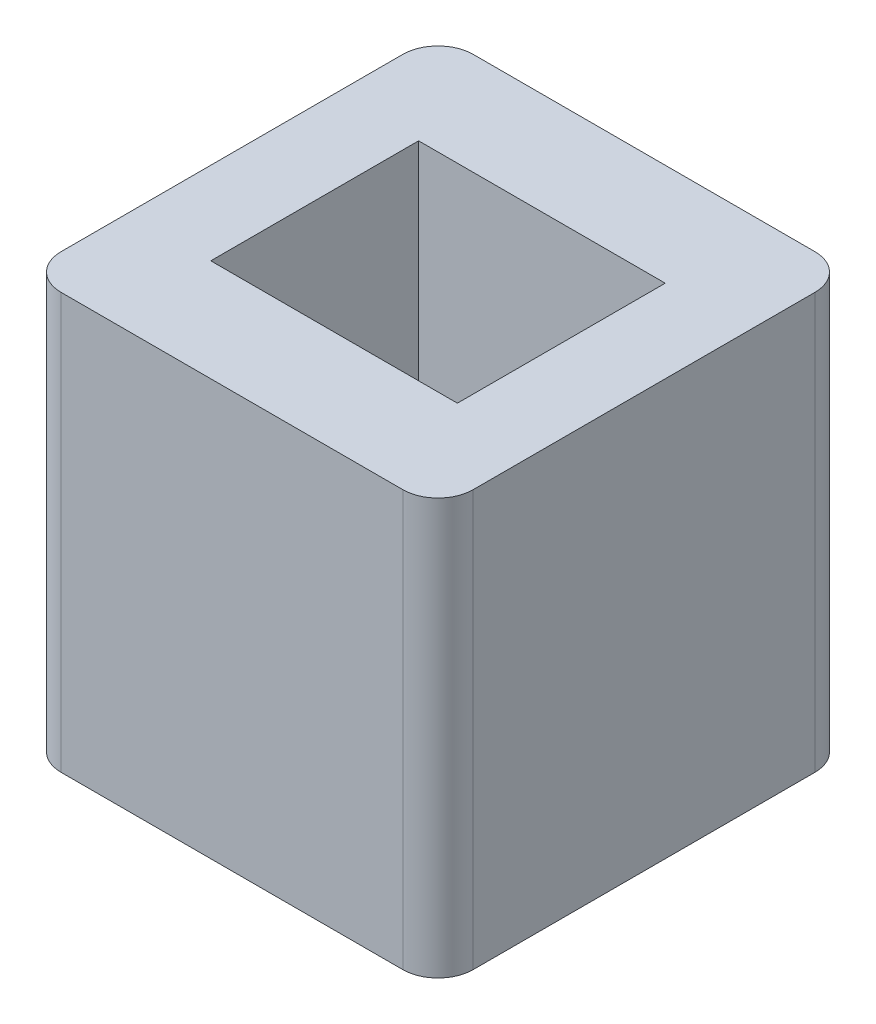
from build123d import *

# Parameters (mm, degrees)
SKETCH1_W           = 35
SKETCH1_H           = 29.5
BOSS_EXTRUDE1_DEPTH = 29.5


with BuildPart() as part:
    # Sketch1 → Boss-Extrude1 (new, symmetric)
    with BuildSketch(Plane(origin=(0, 0, 0), x_dir=(1, 0, 0), z_dir=(0, 1, 0))):
        with BuildLine():
            Line((-24.25, 29.25), (24.25, 29.25))
            ThreePointArc((24.25, 29.25), (27.785533906, 27.785533906), (29.25, 24.25))
            Line((29.25, 24.25), (29.25, -24.25))
            ThreePointArc((29.25, -24.25), (27.785533906, -27.785533906), (24.25, -29.25))
            Line((24.25, -29.25), (-24.25, -29.25))
            ThreePointArc((-24.25, -29.25), (-27.785533906, -27.785533906), (-29.25, -24.25))
            Line((-29.25, -24.25), (-29.25, 24.25))
            ThreePointArc((-29.25, 24.25), (-27.785533906, 27.785533906), (-24.25, 29.25))
        make_face()
        Rectangle(SKETCH1_W, SKETCH1_H, mode=Mode.SUBTRACT)
    extrude(amount=BOSS_EXTRUDE1_DEPTH, both=True)


solid = part.part
